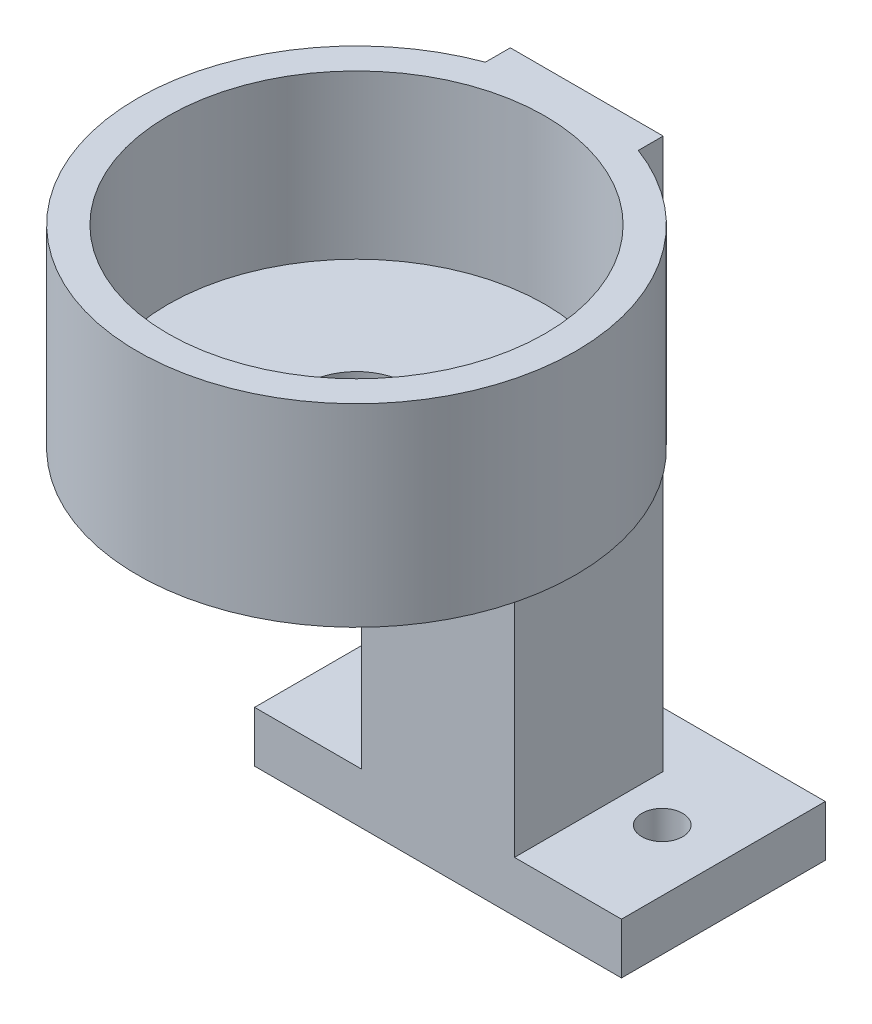
from build123d import *

# Parameters (mm, degrees)
ESQUISSE1_W             = 36
ESQUISSE1_H             = 20
BOSS_EXTRU_1_DEPTH      = 5
ESQUISSE2_W             = 15
ESQUISSE2_H             = 10.591208458
ESQUISSE2_H_2           = 4
BOSS_EXTRU_2_DEPTH      = 32
ESQUISSE3_R             = 5
BOSS_EXTRU_3_DEPTH      = 6
ESQUISSE4_R             = 21.5
ESQUISSE4_R_2           = 18.5
BOSS_EXTRU_4_DEPTH      = 16
BOSS_EXTRU_5_START      = -3
ESQUISSE5_R             = 21.5
ESQUISSE5_R_2           = 7.5
BOSS_EXTRU_5_DEPTH      = 3
ESQUISSE6_W             = 15
ESQUISSE6_H             = 3.413220749
BOSS_EXTRU_6_DEPTH      = 16
ESQUISSE8_R             = 2
ENL_V_MAT_EXTRU_1_DEPTH = 16


with BuildPart() as part:
    # Esquisse1 → Boss.-Extru.1 (new body)
    with BuildSketch(Plane(origin=(0, 0, 0), x_dir=(1, 0, 0), z_dir=(0, 1, 0))):
        with Locations((18, 10)):
            Rectangle(ESQUISSE1_W, ESQUISSE1_H)
    extrude(amount=BOSS_EXTRU_1_DEPTH)

    # Esquisse2 → Boss.-Extru.2 (add)
    with BuildSketch(Plane(origin=(0, 5, 0), x_dir=(1, 0, 0), z_dir=(0, 1, 0))):
        with Locations((18, 5.295604229)):
            Rectangle(ESQUISSE2_W, ESQUISSE2_H)
        with Locations((18, 12.591208458)):
            Rectangle(ESQUISSE2_W, ESQUISSE2_H_2)
    extrude(amount=BOSS_EXTRU_2_DEPTH)

    # Esquisse3 → Boss.-Extru.3 (add)
    with BuildSketch(Plane(origin=(0, 37, 0), x_dir=(1, 0, 0), z_dir=(0, 1, 0))):
        with BuildLine():
            Line((10.5, 14.591208458), (10.5, -8))
            ThreePointArc((10.5, -8), (18, -15.5), (25.5, -8))
            Line((25.5, -8), (25.5, 14.591208458))
            Line((25.5, 14.591208458), (10.5, 14.591208458))
        make_face()
        with Locations(Location((18, -8, 0), (0, 0, 270))):
            Circle(ESQUISSE3_R, mode=Mode.SUBTRACT)
    extrude(amount=BOSS_EXTRU_3_DEPTH)

    # Esquisse4 → Boss.-Extru.4 (add)
    with BuildSketch(Plane(origin=(0, 43, 0), x_dir=(1, 0, 0), z_dir=(0, 1, 0))):
        with Locations(Location((18, -8, 0), (0, 0, 69.583789871))):
            Circle(ESQUISSE4_R)
        with Locations(Location((18, -8, 0), (0, 0, 66.083465578))):
            Circle(ESQUISSE4_R_2, mode=Mode.SUBTRACT)
    extrude(amount=BOSS_EXTRU_4_DEPTH)

    # Esquisse5 → Boss.-Extru.5 (add)
    with BuildSketch(Plane(origin=(0, 43, 0), x_dir=(1, 0, 0), z_dir=(0, 1, 0)).offset(BOSS_EXTRU_5_START)):
        with Locations(Location((18, -8, 0), (0, 0, 69.583789871))):
            Circle(ESQUISSE5_R)
        with Locations((18, -8)):
            Circle(ESQUISSE5_R_2, mode=Mode.SUBTRACT)
    extrude(amount=BOSS_EXTRU_5_DEPTH)

    # Esquisse6 → Boss.-Extru.6 (add)
    with BuildSketch(Plane(origin=(0, 43, 0), x_dir=(1, 0, 0), z_dir=(0, 1, 0))):
        with Locations((18, 12.884598084)):
            Rectangle(ESQUISSE6_W, ESQUISSE6_H)
    extrude(amount=BOSS_EXTRU_6_DEPTH)

    # Esquisse8 → Enlèv. mat.-Extru.1 (cut)
    with BuildSketch(Plane.XZ):
        with Locations(Location((6, -10, 0), (0, 0, 270))):
            Circle(ESQUISSE8_R)
        with Locations(Location((30, -10, 0), (0, 0, 270))):
            Circle(ESQUISSE8_R)
    extrude(amount=-ENL_V_MAT_EXTRU_1_DEPTH, mode=Mode.SUBTRACT)


solid = part.part
